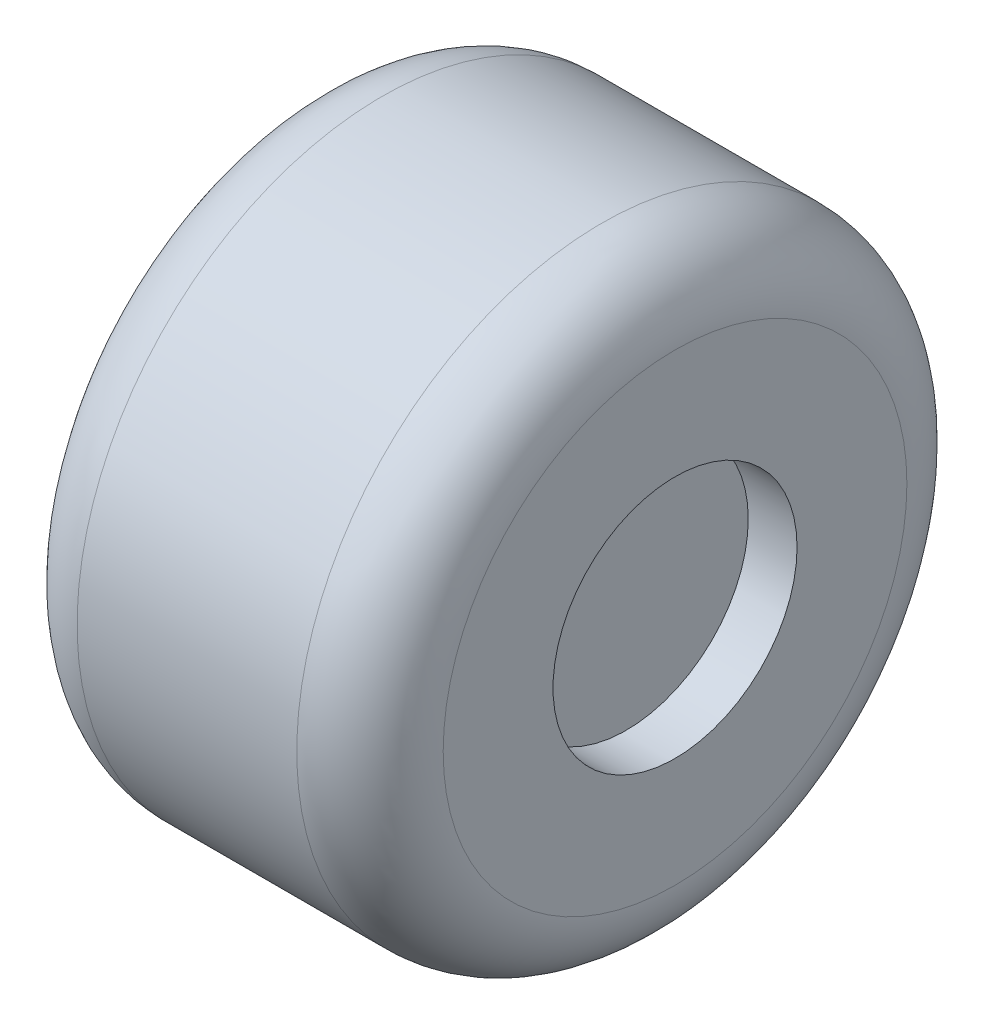
from build123d import *

# Parameters (mm, degrees)
SKETCH1_R           = 125
BOSS_EXTRUDE1_DEPTH = 75
FILLET1_R           = 30
SKETCH2_R           = 50
CUT_EXTRUDE1_DEPTH  = 20
SKETCH3_R           = 30
CUT_EXTRUDE2_DEPTH  = 50


with BuildPart() as part:
    # Sketch1 → Boss-Extrude1 (new, symmetric)
    with BuildSketch(Plane(origin=(0, 0, 0), x_dir=(0, 0, -1), z_dir=(1, 0, 0))):
        Circle(SKETCH1_R)
    extrude(amount=BOSS_EXTRUDE1_DEPTH, both=True)

    # Fillet1
    fillet1_edges = [part.edges().sort_by_distance(p)[0] for p in [
        (-75, 0, 125),
        (75, 0, 125),
    ]]
    fillet(fillet1_edges, radius=FILLET1_R)

    # Sketch2 → Cut-Extrude1 (cut)
    with BuildSketch(Plane(origin=(75, 0, 0), x_dir=(0, 0, -1), z_dir=(1, 0, 0))):
        Circle(SKETCH2_R)
    extrude(amount=-CUT_EXTRUDE1_DEPTH, mode=Mode.SUBTRACT)

    # Sketch3 → Cut-Extrude2 (cut)
    with BuildSketch(Plane.ZY.offset(75)):
        Circle(SKETCH3_R)
    extrude(amount=-CUT_EXTRUDE2_DEPTH, mode=Mode.SUBTRACT)


solid = part.part
